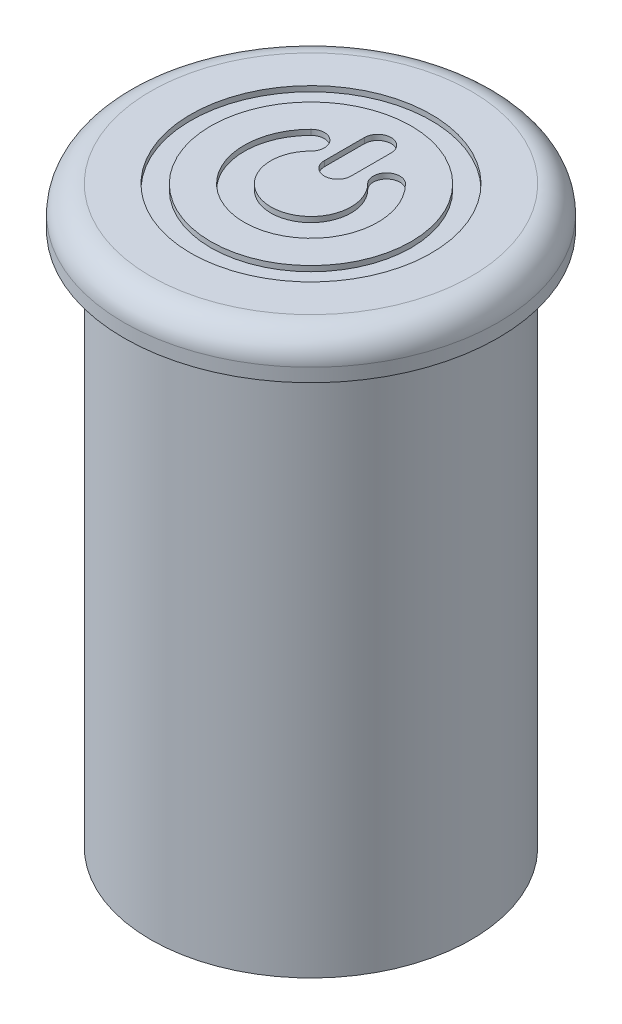
from build123d import *

# Parameters (mm, degrees)
FILLET_1_R          = 1
SKETCH_2_R          = 4.5
SKETCH_2_R_2        = 3.75
CUT_EXTRUDE_1_DEPTH = 0.2


with BuildPart() as part:
    # 草图1 → 旋转1 (revolve)
    with BuildSketch(Plane.XY, mode=Mode.PRIVATE) as revolve_1_sk:
        Polygon((0, 0), (7, 0), (7, -1.5), (6, -1.5), (6, -21.5), (0, -21.5), align=None)
    revolve(revolve_1_sk.sketch.rotate(Axis((0, 0, 0), (0, 1, 0)), 90), axis=Axis((0, 0, 0), (0, 1, 0)))

    # 圆角1
    fillet_1_edges = [part.edges().sort_by_distance(p)[0] for p in [
        (0, 0, 7),
    ]]
    fillet(fillet_1_edges, radius=FILLET_1_R)

    # 草图2 → 切除-拉伸1 (cut)
    # profile 1 of 3: a face of its own
    with BuildSketch(Plane(origin=(0, 0, 0), x_dir=(1, 0, 0), z_dir=(0, 1, 0))):
        with Locations(Location((0, 0, 0), (0, 0, 270))):
            Circle(SKETCH_2_R)
        with Locations(Location((0, 0, 0), (0, 0, 270))):
            Circle(SKETCH_2_R_2, mode=Mode.SUBTRACT)
    # profile 2 of 3: a face of its own
    with BuildSketch(Plane(origin=(0, 0, 0), x_dir=(1, 0, 0), z_dir=(0, 1, 0))):
        with BuildLine():
            ThreePointArc((-1.767766953, 1.767766953), (0, -2.5), (1.767766953, 1.767766953))
            ThreePointArc((1.767766953, 1.767766953), (1.060660172, 1.767766953), (1.060660172, 1.060660172))
            ThreePointArc((1.060660172, 1.060660172), (0, -1.5), (-1.060660172, 1.060660172))
            ThreePointArc((-1.060660172, 1.060660172), (-1.060660172, 1.767766953), (-1.767766953, 1.767766953))
        make_face()
    # profile 3 of 3: a face of its own
    with BuildSketch(Plane(origin=(0, 0, 0), x_dir=(1, 0, 0), z_dir=(0, 1, 0))):
        with BuildLine():
            Line((-0.5, 2.5), (-0.5, 1))
            ThreePointArc((-0.5, 1), (0, 0.5), (0.5, 1))
            Line((0.5, 1), (0.5, 2.5))
            ThreePointArc((0.5, 2.5), (0, 3), (-0.5, 2.5))
        make_face()
    extrude(amount=-CUT_EXTRUDE_1_DEPTH, mode=Mode.SUBTRACT)


solid = part.part
